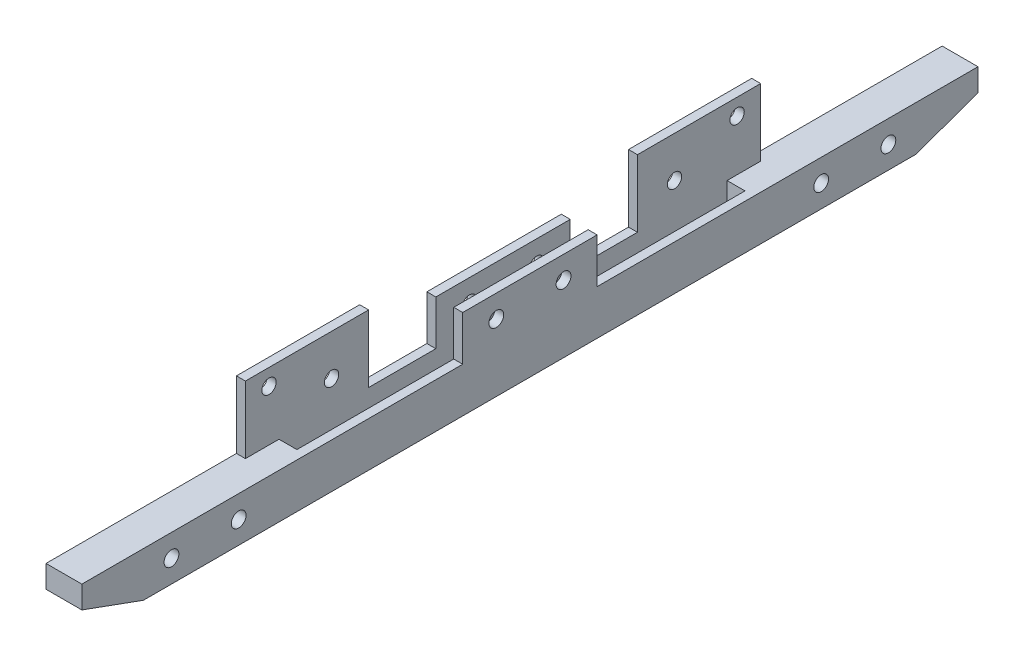
from build123d import *
from OCP.BRepFilletAPI import BRepFilletAPI_MakeChamfer

# Parameters (mm, degrees)
SKETCH_2_W          = 8
SKETCH_2_H          = 200
EXTRUDE_1_DEPTH     = 10
SKETCH_3_W          = 2
SKETCH_3_H          = 30
EXTRUDE_2_DEPTH     = 10
SKETCH_4_R          = 1.65
CUT_EXTRUDE_1_DEPTH = 20
SKETCH_5_W          = 4
SKETCH_5_H          = 100
CUT_EXTRUDE_2_DEPTH = 20
CHAMFER_1_SIZE      = 5
CHAMFER_1_SIZE2     = 13.737387097
SKETCH_6_W          = 2
SKETCH_6_H          = 27.5
EXTRUDE_3_DEPTH     = 15
SKETCH_7_R          = 1.65
CUT_EXTRUDE_3_DEPTH = 10
SKETCH_8_R          = 1.6
CUT_EXTRUDE_4_DEPTH = 10


with BuildPart() as part:
    # 草图2 → 凸台-拉伸1 (new body)
    with BuildSketch(Plane(origin=(0, 0, 0), x_dir=(1, 0, 0), z_dir=(0, 1, 0))):
        Rectangle(SKETCH_2_W, SKETCH_2_H)
    extrude(amount=EXTRUDE_1_DEPTH)

    # 草图3 → 凸台-拉伸2 (add)
    with BuildSketch(Plane(origin=(0, 10, 0), x_dir=(1, 0, 0), z_dir=(0, 1, 0))):
        with Locations((-3, 0)):
            Rectangle(SKETCH_3_W, SKETCH_3_H)
        with Locations((3, 0)):
            Rectangle(SKETCH_3_W, SKETCH_3_H)
    extrude(amount=EXTRUDE_2_DEPTH)

    # 草图4 → 切除-拉伸1 (cut)
    with BuildSketch(Plane.ZY.offset(4)):
        with Locations((-7.5, 15)):
            Circle(SKETCH_4_R)
        with Locations((7.5, 15)):
            Circle(SKETCH_4_R)
    extrude(amount=-CUT_EXTRUDE_1_DEPTH, mode=Mode.SUBTRACT)

    # 草图5 → 切除-拉伸2 (cut)
    with BuildSketch(Plane(origin=(0, 10, 0), x_dir=(1, 0, 0), z_dir=(0, 1, 0))):
        Rectangle(SKETCH_5_W, SKETCH_5_H)
    extrude(amount=-CUT_EXTRUDE_2_DEPTH, mode=Mode.SUBTRACT)

    # 倒角1: one chamfer whose edges measure the first distance from different faces: ONE call of the kernel's chamfer builder (chamfer() names one face for all edges)
    chamfer_1_edges_1 = [part.edges().sort_by_distance(p)[0] for p in [
        (0, 0, 100),
    ]]
    chamfer_1_side_1 = [part.faces().sort_by_distance(p)[0] for p in [
        (0, 5, 100),
    ]]
    chamfer_1_edges_2 = [part.edges().sort_by_distance(p)[0] for p in [
        (0, 0, -100),
    ]]
    chamfer_1_side_2 = [part.faces().sort_by_distance(p)[0] for p in [
        (0, 5, -100),
    ]]
    chamfer_1 = BRepFilletAPI_MakeChamfer(part.part.solid().wrapped)
    for e in chamfer_1_edges_1:
        chamfer_1.Add(CHAMFER_1_SIZE, CHAMFER_1_SIZE2, e.wrapped, chamfer_1_side_1[0].wrapped)  # the first distance lies on this face
    for e in chamfer_1_edges_2:
        chamfer_1.Add(CHAMFER_1_SIZE, CHAMFER_1_SIZE2, e.wrapped, chamfer_1_side_2[0].wrapped)  # the first distance lies on this face
    add(Compound.cast(chamfer_1.Shape()), mode=Mode.REPLACE)

    # 草图6 → 凸台-拉伸3 (add)
    with BuildSketch(Plane(origin=(0, 10, 0), x_dir=(1, 0, 0), z_dir=(0, 1, 0))):
        with Locations((-3, 43.75)):
            Rectangle(SKETCH_6_W, SKETCH_6_H)
    extrude_3 = extrude(amount=EXTRUDE_3_DEPTH)

    # 镜向2: 凸台-拉伸3 across plane
    add(extrude_3.mirror(Plane.XY))

    # 草图7 → 切除-拉伸3 (cut)
    with BuildSketch(Plane.ZY.offset(4)):
        with Locations((80, 5)):
            Circle(SKETCH_7_R)
        with Locations((65, 5)):
            Circle(SKETCH_7_R)
        with Locations((-65, 5)):
            Circle(SKETCH_7_R)
        with Locations((-80, 5)):
            Circle(SKETCH_7_R)
    extrude(amount=-CUT_EXTRUDE_3_DEPTH, mode=Mode.SUBTRACT)

    # 草图8 → 切除-拉伸4 (cut)
    with BuildSketch(Plane(origin=(-2, 0, 0), x_dir=(0, 0, -1), z_dir=(1, 0, 0))):
        with Locations((-52.235249282, 21.351499314)):
            Circle(SKETCH_8_R)
        with Locations((-38.268733006, 15.880080566)):
            Circle(SKETCH_8_R)
        with Locations((38.268733006, 15.880080566)):
            Circle(SKETCH_8_R)
        with Locations((52.235249282, 21.351499314)):
            Circle(SKETCH_8_R)
    extrude(amount=-CUT_EXTRUDE_4_DEPTH, mode=Mode.SUBTRACT)


solid = part.part
